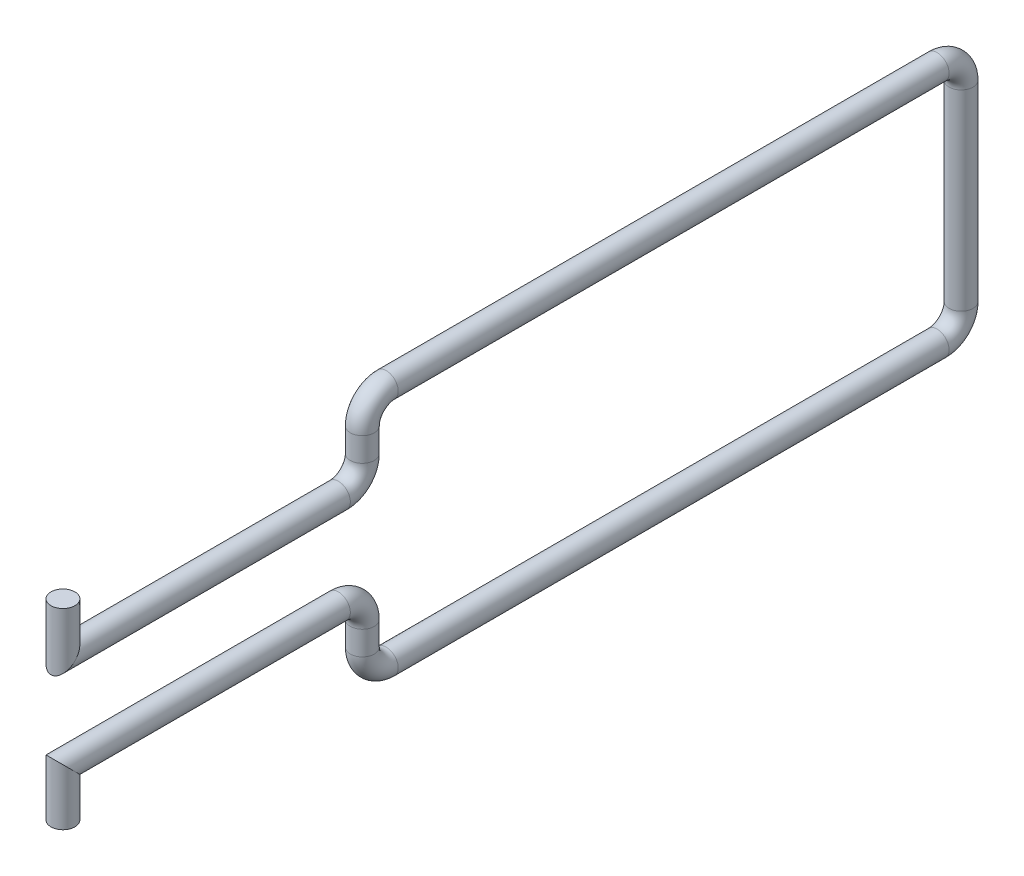
from build123d import *

# Parameters (mm, degrees)
SKIZZE5_R = 1


with BuildPart() as part:
    # Austragung1: sweep along a path in Skizze1
    with BuildLine(Plane(origin=(0, 0, 0), x_dir=(0, 0, -1), z_dir=(1, 0, 0))) as austragung1_path:
        Line((0, 8), (0, 4))
        Line((0, 4), (23, 4))
        ThreePointArc((23, 4), (24.414213562, 4.585786438), (25, 6))
        Line((25, 6), (25, 8))
        ThreePointArc((25, 8), (25.585786438, 9.414213562), (27, 10))
        Line((27, 10), (73, 10))
        ThreePointArc((73, 10), (74.414213562, 9.414213562), (75, 8))
        Line((75, 8), (75, -8))
        ThreePointArc((75, -8), (74.414213562, -9.414213562), (73, -10))
        Line((73, -10), (27, -10))
        ThreePointArc((27, -10), (25.585786438, -9.414213562), (25, -8))
        Line((25, -8), (25, -6))
        ThreePointArc((25, -6), (24.414213562, -4.585786438), (23, -4))
        Line((23, -4), (0, -4))
        Line((0, -4), (0, -8))
    # Skizze5 → Austragung1 (sweep)
    with BuildSketch(Plane(origin=(0, 8, 0), x_dir=(1, 0, 0), z_dir=(0, 1, 0))):
        Circle(SKIZZE5_R)
    sweep(path=austragung1_path.line, transition=Transition.RIGHT)


solid = part.part
